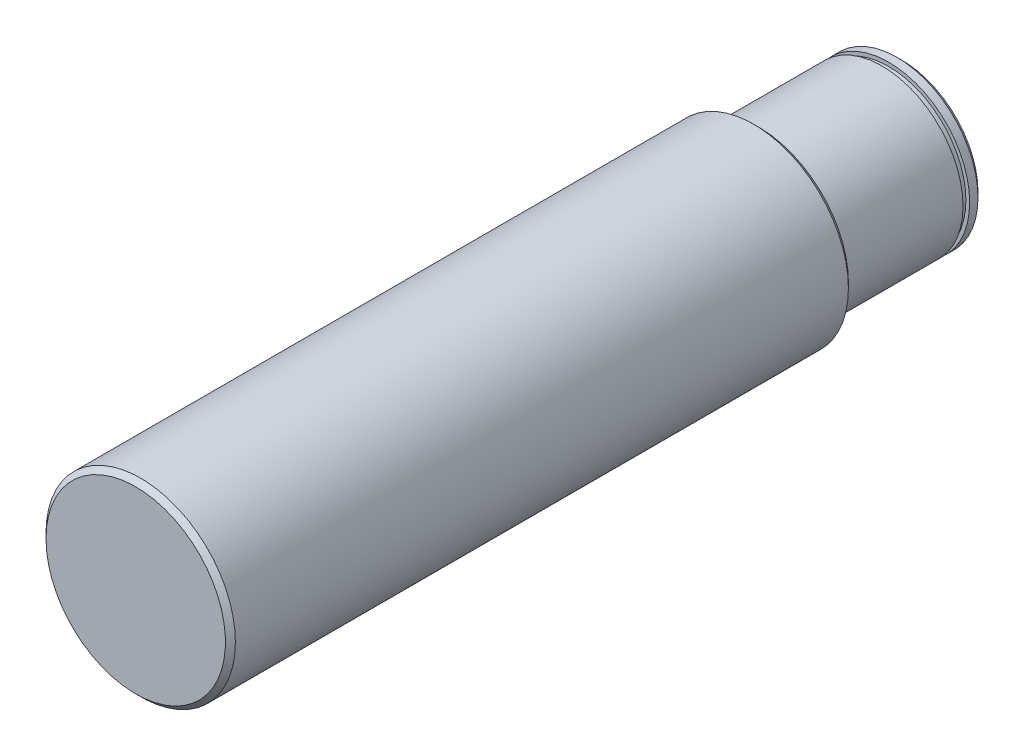
from build123d import *

# Parameters (mm, degrees)
CHAMFER_1_SIZE = 2


with BuildPart() as part:
    # Эскиз1 → Повернуть1 (revolve)
    with BuildSketch(Plane(origin=(0, 0, 0), x_dir=(0, 0, -1), z_dir=(1, 0, 0)), mode=Mode.PRIVATE) as revolve_1_sk:
        Polygon((0, 0), (0, 38), (250, 38), (250, 32.5), (299.5, 32.5), (299.5, 31), (302.15, 31), (302.15, 32.5), (307.5, 32.5), (307.5, 0), align=None)
    revolve(revolve_1_sk.sketch.rotate(Axis((0, 0, 0), (0, 0, -1)), 90), axis=Axis((0, 0, 0), (0, 0, -1)))

    # Фаска1
    chamfer_1_edges = [part.edges().sort_by_distance(p)[0] for p in [
        (-38, 0, -250),
        (-38, 0, 0),
        (-32.5, 0, -307.5),
    ]]
    chamfer(chamfer_1_edges, length=CHAMFER_1_SIZE)


solid = part.part
